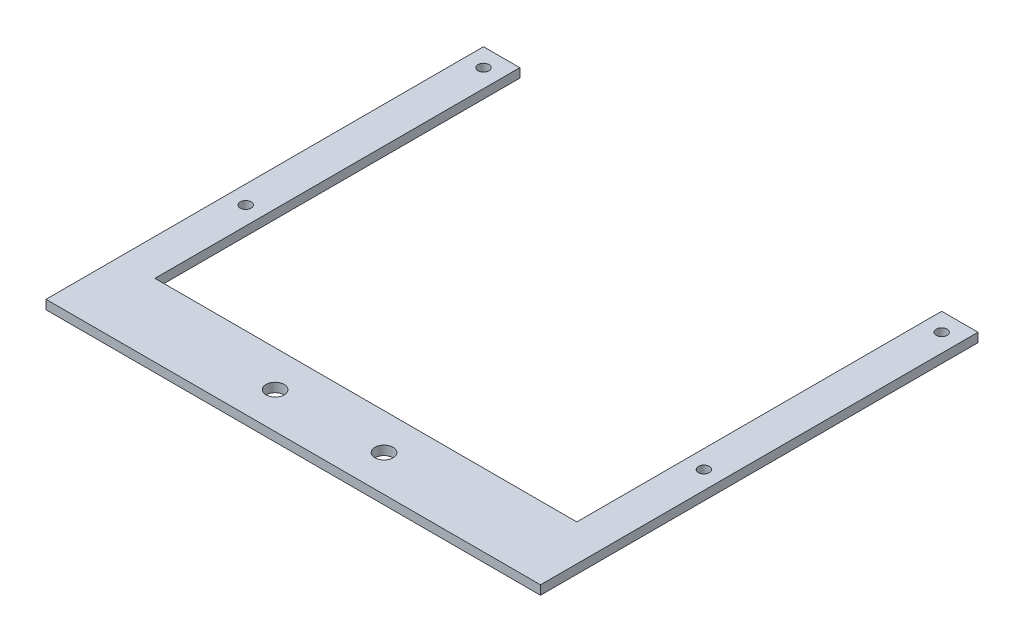
from build123d import *

# Parameters (mm, degrees)
SKETCH3_R           = 1.5
SKETCH3_R_2         = 2.5
BOSS_EXTRUDE2_DEPTH = 2.5


with BuildPart() as part:
    # Sketch3 → Boss-Extrude2 (new body)
    with BuildSketch(Plane(origin=(0, 0, 0), x_dir=(1, 0, 0), z_dir=(0, 1, 0))):
        Polygon((-68.1, 70.5), (-58.1, 70.5), (-58.1, -30), (58.1, -30), (58.1, 70.5), (68.1, 70.5), (68.1, -50), (-68.1, -50), align=None)
        with Locations(Location((-63.1, 65.5, 0), (0, 0, 270))):
            Circle(SKETCH3_R, mode=Mode.SUBTRACT)
        with Locations(Location((-63.1, 0, 0), (0, 0, 270))):
            Circle(SKETCH3_R, mode=Mode.SUBTRACT)
        with Locations(Location((63.1, 0, 0), (0, 0, 90))):
            Circle(SKETCH3_R, mode=Mode.SUBTRACT)
        with Locations(Location((63.1, 65.5, 0), (0, 0, 90))):
            Circle(SKETCH3_R, mode=Mode.SUBTRACT)
        with Locations(Location((-15, -40, 0), (0, 0, 270))):
            Circle(SKETCH3_R_2, mode=Mode.SUBTRACT)
        with Locations(Location((15, -40, 0), (0, 0, 90))):
            Circle(SKETCH3_R_2, mode=Mode.SUBTRACT)
    extrude(amount=BOSS_EXTRUDE2_DEPTH)


solid = part.part
